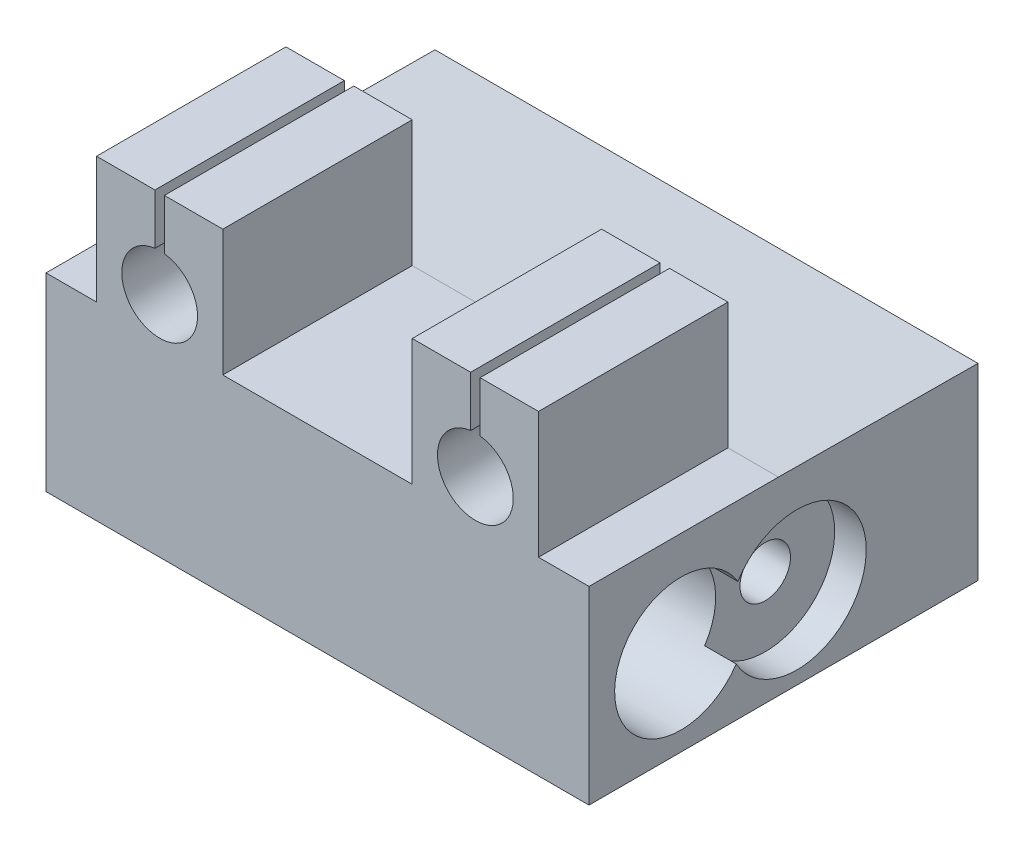
from build123d import *

# Parameters (mm, degrees)
EXTRUDE_1_DEPTH     = 30
SKETCH_2_R          = 10.5
CUT_EXTRUDE_1_DEPTH = 104.903801663
EXTRUDE_3_DEPTH     = 86
SKETCH_5_R          = 4
CUT_EXTRUDE_3_DEPTH = 86
SKETCH_6_R          = 11
CUT_EXTRUDE_4_DEPTH = 5
CUT_EXTRUDE_START   = -5
SKETCH_7_R          = 11
CUT_EXTRUDE_5_DEPTH = 5


with BuildPart() as part:
    # Эскиз1 → Бобышка-Вытянуть1 (new body)
    with BuildSketch(Plane.XY):
        with BuildLine():
            Line((-43, 0), (-43, 30))
            Line((-43, 30), (-35, 30))
            Line((-35, 30), (-35, 50))
            Line((-35, 50), (-25.75, 50))
            Line((-25.75, 50), (-25.75, 42))
            ThreePointArc((-25.75, 42), (-25, 30.04705955), (-24.25, 42))
            Line((-24.25, 42), (-24.25, 50))
            Line((-24.25, 50), (-15, 50))
            Line((-15, 50), (-15, 30))
            Line((-15, 30), (0, 30))
            Line((0, 30), (15, 30))
            Line((15, 30), (15, 50))
            Line((15, 50), (24.25, 50))
            Line((24.25, 50), (24.25, 42))
            ThreePointArc((24.25, 42), (25, 30.04705955), (25.75, 42))
            Line((25.75, 42), (25.75, 50))
            Line((25.75, 50), (35, 50))
            Line((35, 50), (35, 30))
            Line((35, 30), (43, 30))
            Line((43, 30), (43, 0))
            Line((43, 0), (0, 0))
            Line((0, 0), (-43, 0))
        make_face()
    extrude(amount=EXTRUDE_1_DEPTH)

    # Эскиз2 → Вырез-Вытянуть1 (cut, through all)
    with BuildSketch(Plane.ZY.offset(43)):
        with Locations((15.445285693, 13.511926699)):
            Circle(SKETCH_2_R)
    extrude(amount=-CUT_EXTRUDE_1_DEPTH, mode=Mode.SUBTRACT)

    # Эскиз4 → Бобышка-Вытянуть3 (add)
    with BuildSketch(Plane(origin=(43, 0, 0), x_dir=(0, 0, -1), z_dir=(1, 0, 0))):
        Polygon((0, 0), (31.600345964, 0), (31.600345964, 29.791908919), (0, 30), align=None)
    extrude(amount=-EXTRUDE_3_DEPTH)

    # Эскиз5 → Вырез-Вытянуть3 (cut)
    with BuildSketch(Plane.ZY.offset(43)):
        with Locations((-2.905780264, 13.079264153)):
            Circle(SKETCH_5_R)
    extrude(amount=-CUT_EXTRUDE_3_DEPTH, mode=Mode.SUBTRACT)

    # Эскиз6 → Вырез-Вытянуть4 (cut)
    with BuildSketch(Plane.ZY.offset(43)):
        with Locations((-2.905780264, 13.079264153)):
            Circle(SKETCH_6_R)
    extrude(amount=-CUT_EXTRUDE_4_DEPTH, mode=Mode.SUBTRACT)

    # Эскиз7 → Вырез-Вытянуть5 (cut)
    with BuildSketch(Plane(origin=(43, 0, 0), x_dir=(0, 0, -1), z_dir=(1, 0, 0)).offset(CUT_EXTRUDE_START)):
        with Locations((2.905780264, 13.079264153)):
            Circle(SKETCH_7_R)
    extrude(amount=CUT_EXTRUDE_5_DEPTH, mode=Mode.SUBTRACT)


solid = part.part
